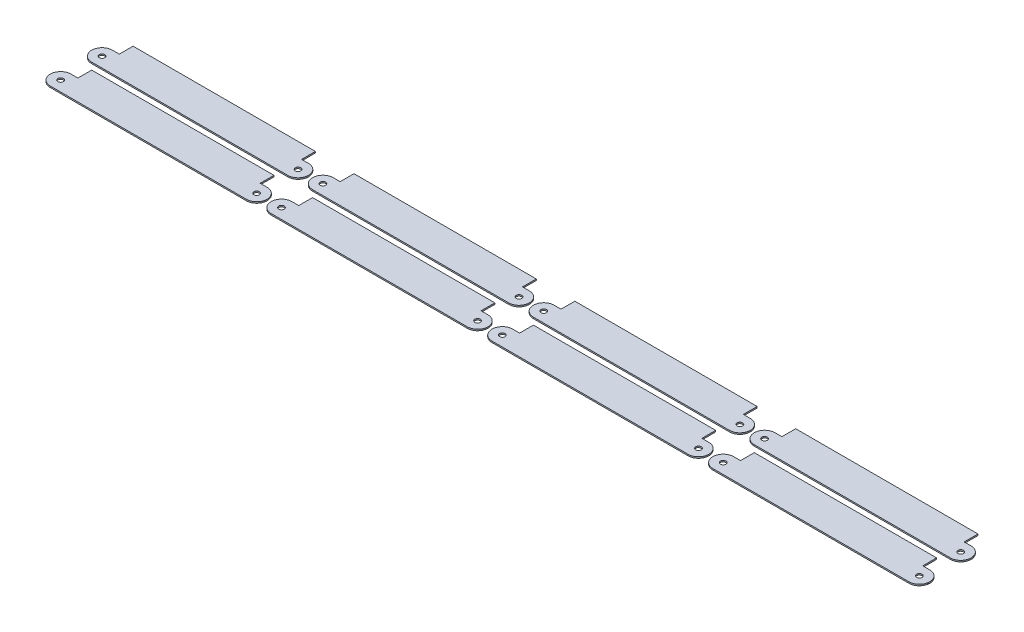
from build123d import *

# Parameters (mm, degrees)
SKETCH1_R           = 2
BOSS_EXTRUDE1_DEPTH = 1
LPATTERN1_COUNT     = 4
LPATTERN1_PITCH     = 160
LPATTERN1_2_COUNT   = 2
LPATTERN1_2_PITCH   = 30


with BuildPart() as part:
    # Sketch1 → Boss-Extrude1 (new body)
    with BuildSketch(Plane(origin=(0, 0, 0), x_dir=(1, 0, 0), z_dir=(0, 1, 0))):
        with BuildLine():
            Line((5, 7.5), (0, 7.5))
            ThreePointArc((0, 7.5), (-4.937104415, 5.645794895), (-7.433034374, 1))
            Line((-7.433034374, 1), (-7.5, 1))
            Line((-7.5, 1), (-7.5, -1))
            Line((-7.5, -1), (-7.433034374, -1))
            ThreePointArc((-7.433034374, -1), (-4.937104415, -5.645794895), (0, -7.5))
            Line((0, -7.5), (142.06, -7.5))
            ThreePointArc((142.06, -7.5), (146.997104415, -5.645794895), (149.493034374, -1))
            Line((149.493034374, -1), (149.56, -1))
            Line((149.56, -1), (149.56, 1))
            Line((149.56, 1), (149.493034374, 1))
            ThreePointArc((149.493034374, 1), (146.997104415, 5.645794895), (142.06, 7.5))
            Line((142.06, 7.5), (137.06, 7.5))
            Line((137.06, 7.5), (137.06, 17.5))
            Line((137.06, 17.5), (5, 17.5))
            Line((5, 17.5), (5, 7.5))
        make_face()
        Circle(SKETCH1_R, mode=Mode.SUBTRACT)
        with Locations((142.06, 0)):
            Circle(SKETCH1_R, mode=Mode.SUBTRACT)
    extrude(amount=BOSS_EXTRUDE1_DEPTH)


with BuildPart() as lpattern1_1:
    # LPattern1: pattern copy
    add(part.part.moved(Location(Vector(1, 0, 0) * (1 * LPATTERN1_PITCH))))


with BuildPart() as lpattern1_2:
    # LPattern1: pattern copy
    add(part.part.moved(Location(Vector(1, 0, 0) * (2 * LPATTERN1_PITCH))))


with BuildPart() as lpattern1_3:
    # LPattern1: pattern copy
    add(part.part.moved(Location(Vector(1, 0, 0) * (3 * LPATTERN1_PITCH))))


with BuildPart() as lpattern1_2_1:
    # LPattern1 2: pattern copy
    add(part.part.moved(Location(Vector(0, 0, -1) * (1 * LPATTERN1_2_PITCH))))


with BuildPart() as lpattern1_2_2:
    # LPattern1 2: pattern copy
    add(lpattern1_1.part.moved(Location(Vector(0, 0, -1) * (1 * LPATTERN1_2_PITCH))))


with BuildPart() as lpattern1_2_3:
    # LPattern1 2: pattern copy
    add(lpattern1_2.part.moved(Location(Vector(0, 0, -1) * (1 * LPATTERN1_2_PITCH))))


with BuildPart() as lpattern1_2_4:
    # LPattern1 2: pattern copy
    add(lpattern1_3.part.moved(Location(Vector(0, 0, -1) * (1 * LPATTERN1_2_PITCH))))


solid = Compound([part.part, lpattern1_1.part, lpattern1_2.part, lpattern1_3.part, lpattern1_2_1.part, lpattern1_2_2.part, lpattern1_2_3.part, lpattern1_2_4.part])
